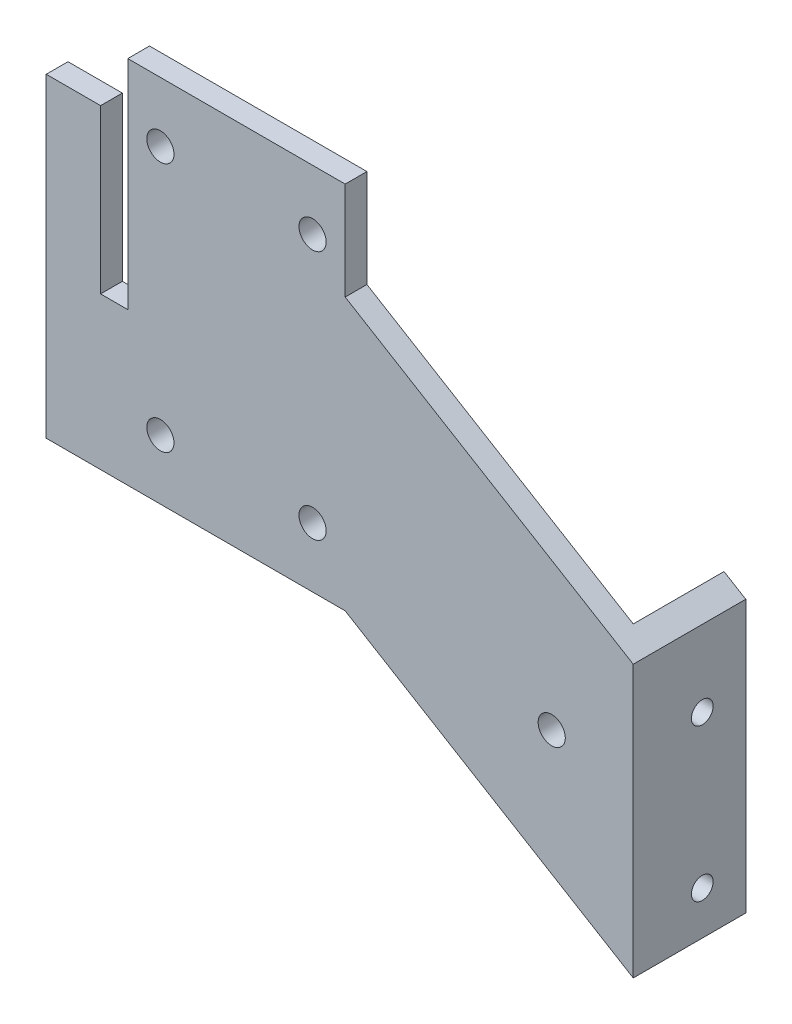
from build123d import *

# Parameters (mm, degrees)
SKETCH_1_R          = 2.5
EXTRUDE_1_DEPTH     = 4
EXTRUDE_2_DEPTH     = 20.7
SKETCH_3_R          = 2
CUT_EXTRUDE_1_DEPTH = 6.7
CUT_EXTRUDE_3_DEPTH = 10


with BuildPart() as part:
    # Эскиз1 → Бобышка-Вытянуть1 (new body)
    with BuildSketch(Plane.XY):
        Polygon((0, 0), (55, 0), (108, -32), (108, 0), (108, 18), (55, 50), (55, 68), (0, 68), align=None)
        with Locations((21, 57)):
            Circle(SKETCH_1_R, mode=Mode.SUBTRACT)
        with Locations((49, 57)):
            Circle(SKETCH_1_R, mode=Mode.SUBTRACT)
        with Locations((21, 11)):
            Circle(SKETCH_1_R, mode=Mode.SUBTRACT)
        with Locations((49, 11)):
            Circle(SKETCH_1_R, mode=Mode.SUBTRACT)
        with Locations((93, 0)):
            Circle(SKETCH_1_R, mode=Mode.SUBTRACT)
    extrude(amount=EXTRUDE_1_DEPTH)

    # Эскиз2 → Бобышка-Вытянуть2 (add)
    with BuildSketch(Plane.XY.offset(4)):
        Polygon((104, 20.41509434), (104, -29.58490566), (108, -32), (108, 18), align=None)
    extrude(amount=-EXTRUDE_2_DEPTH)

    # Эскиз3 → Вырез-Вытянуть1 (cut)
    with BuildSketch(Plane(origin=(108, 0, 0), x_dir=(0, 0, -1), z_dir=(1, 0, 0))):
        with Locations((8.7, 4)):
            Circle(SKETCH_3_R)
        with Locations((8.7, -24)):
            Circle(SKETCH_3_R)
    extrude(amount=-CUT_EXTRUDE_1_DEPTH, mode=Mode.SUBTRACT)

    # Эскиз4 → Вырез-Вытянуть3 (cut)
    with BuildSketch(Plane(origin=(0, 0, 0), x_dir=(-1, 0, 0), z_dir=(0, 0, -1))):
        Polygon((0, 68), (-15, 68), (-15, 48), (-15, 28), (-10, 28), (-10, 58), (0, 58), align=None)
    extrude(amount=-CUT_EXTRUDE_3_DEPTH, mode=Mode.SUBTRACT)


solid = part.part
